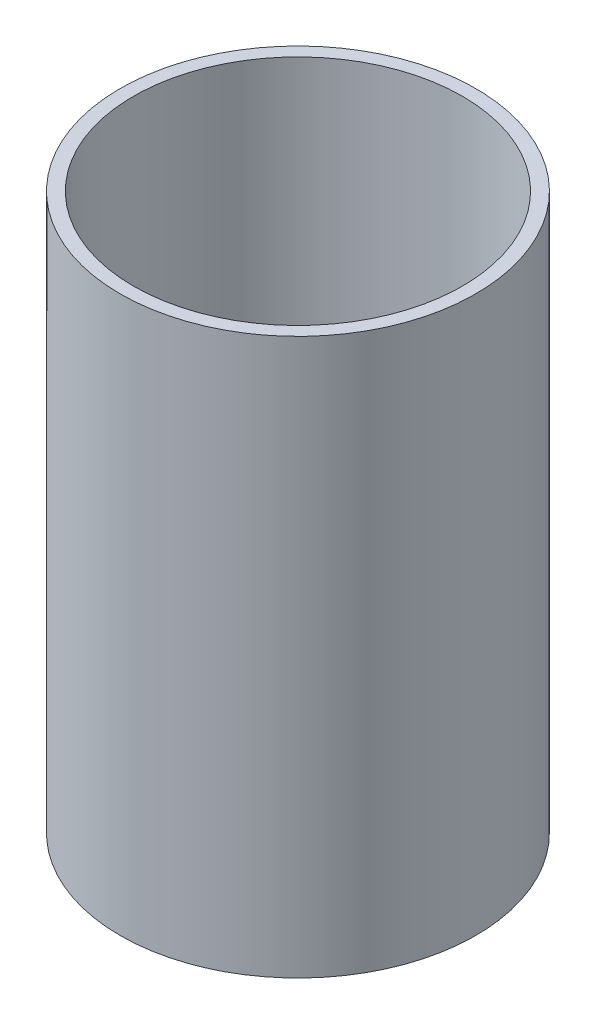
from build123d import *

# Parameters (mm, degrees)
SKETCH1_R           = 16
SKETCH1_R_2         = 14.8
BOSS_EXTRUDE1_DEPTH = 50


with BuildPart() as part:
    # Sketch1 → Boss-Extrude1 (new body)
    with BuildSketch(Plane(origin=(0, 0, 0), x_dir=(1, 0, 0), z_dir=(0, 1, 0))):
        with Locations(Location((0, 0, 0), (0, 0, 270))):
            Circle(SKETCH1_R)
        with Locations(Location((0, 0, 0), (0, 0, 270))):
            Circle(SKETCH1_R_2, mode=Mode.SUBTRACT)
    extrude(amount=BOSS_EXTRUDE1_DEPTH)


solid = part.part
